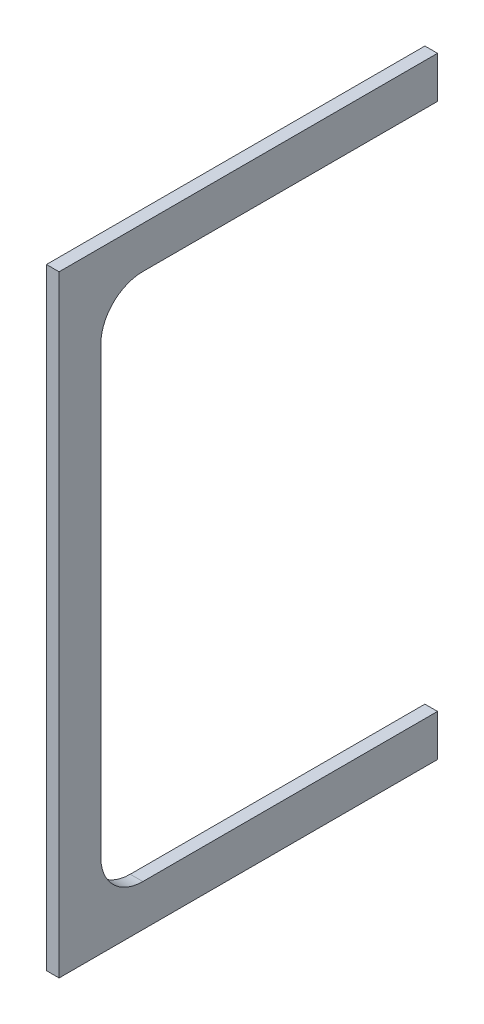
from build123d import *

# Parameters (mm, degrees)
EXTRUDE_1_DEPTH = 3


with BuildPart() as part:
    # Эскиз1 → Бобышка-Вытянуть1 (new body)
    with BuildSketch(Plane(origin=(-1.5, 0, 0), x_dir=(0, -1, 0), z_dir=(-1, 0, 0))):
        with BuildLine():
            Line((-138.5, -36.5), (-138.5, 33.5))
            ThreePointArc((-138.5, 33.5), (-135.571067812, 40.571067812), (-128.5, 43.5))
            Line((-128.5, 43.5), (-23, 43.5))
            ThreePointArc((-23, 43.5), (-15.928932188, 40.571067812), (-13, 33.5))
            Line((-13, 33.5), (-13, -36.5))
            Line((-13, -36.5), (-3.1, -36.5))
            Line((-3.1, -36.5), (-3.1, 53.4))
            Line((-3.1, 53.4), (-148.4, 53.4))
            Line((-148.4, 53.4), (-148.4, -36.5))
            Line((-148.4, -36.5), (-138.5, -36.5))
        make_face()
    extrude(amount=-EXTRUDE_1_DEPTH)


solid = part.part
